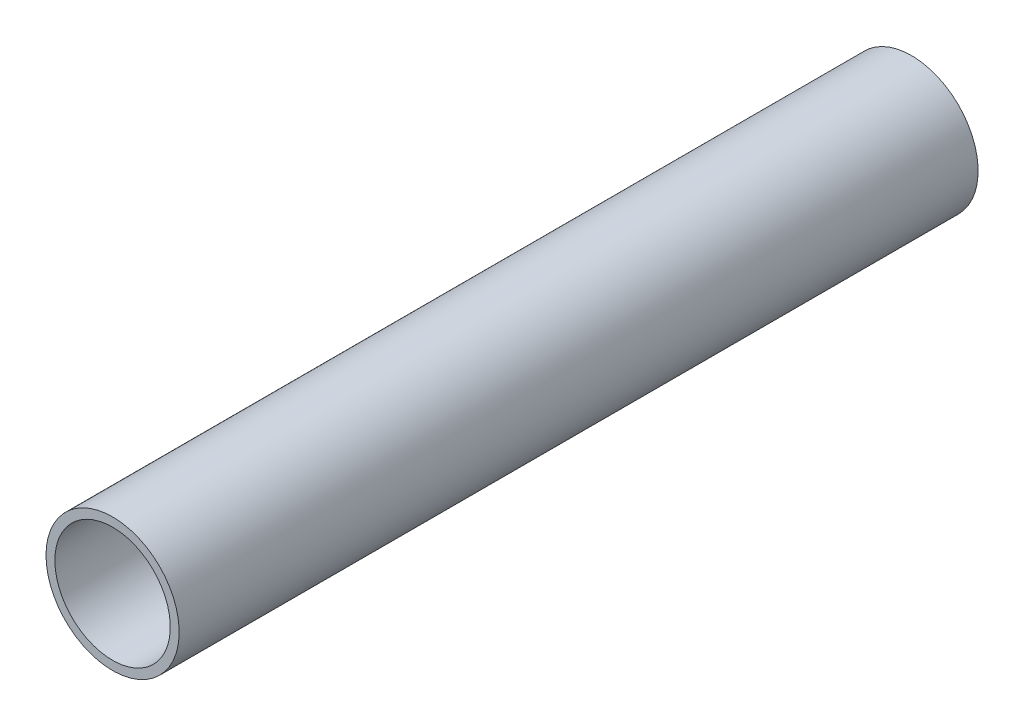
from build123d import *

# Parameters (mm, degrees)
SKETCH1_R           = 7.5
SKETCH1_R_2         = 6.5
BOSS_EXTRUDE1_DEPTH = 90


with BuildPart() as part:
    # Sketch1 → Boss-Extrude1 (new body)
    with BuildSketch(Plane.XY):
        with Locations(Location((0, 0, 0), (0, 0, 180))):
            Circle(SKETCH1_R)
        with Locations(Location((0, 0, 0), (0, 0, 180))):
            Circle(SKETCH1_R_2, mode=Mode.SUBTRACT)
    extrude(amount=BOSS_EXTRUDE1_DEPTH)


solid = part.part
